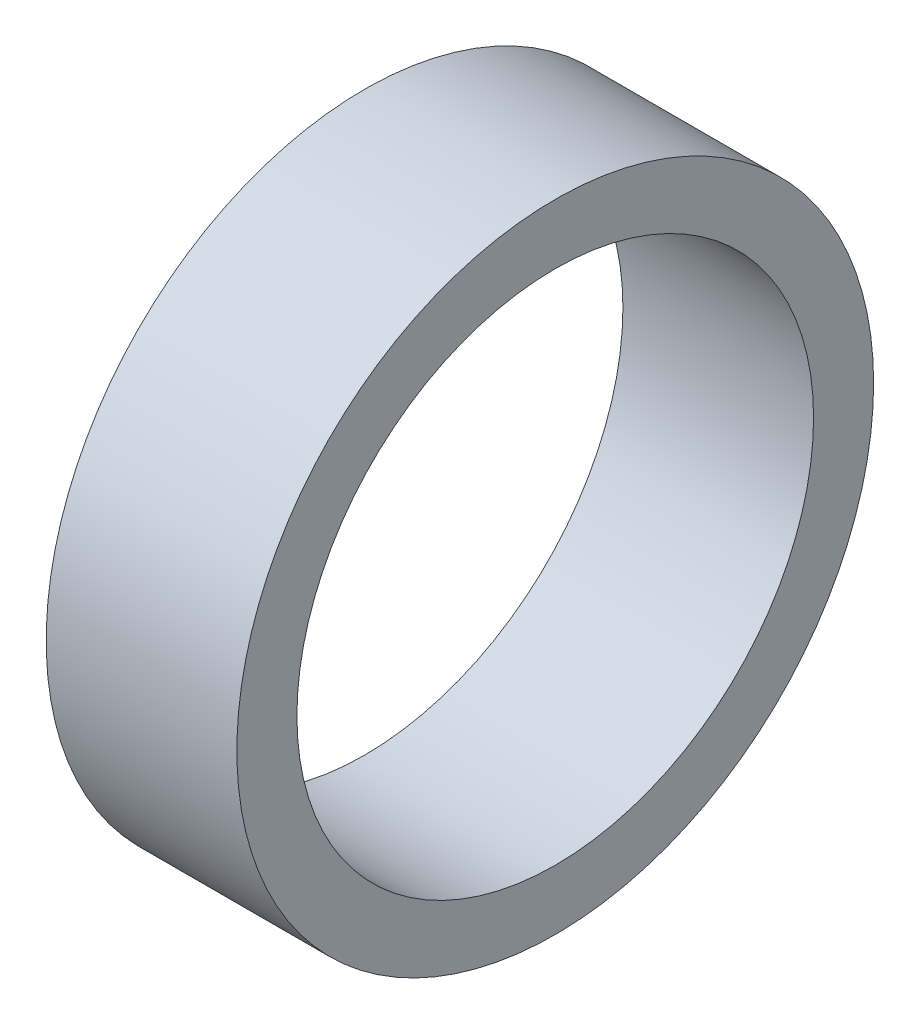
from build123d import *

# Parameters (mm, degrees)
SKETCH1_R           = 33.4
SKETCH1_R_2         = 27.1
BOSS_EXTRUDE1_DEPTH = 10


with BuildPart() as part:
    # Sketch1 → Boss-Extrude1 (new, symmetric)
    with BuildSketch(Plane(origin=(0, 0, 0), x_dir=(0, 0, -1), z_dir=(1, 0, 0))):
        Circle(SKETCH1_R)
        Circle(SKETCH1_R_2, mode=Mode.SUBTRACT)
    extrude(amount=BOSS_EXTRUDE1_DEPTH, both=True)


solid = part.part
